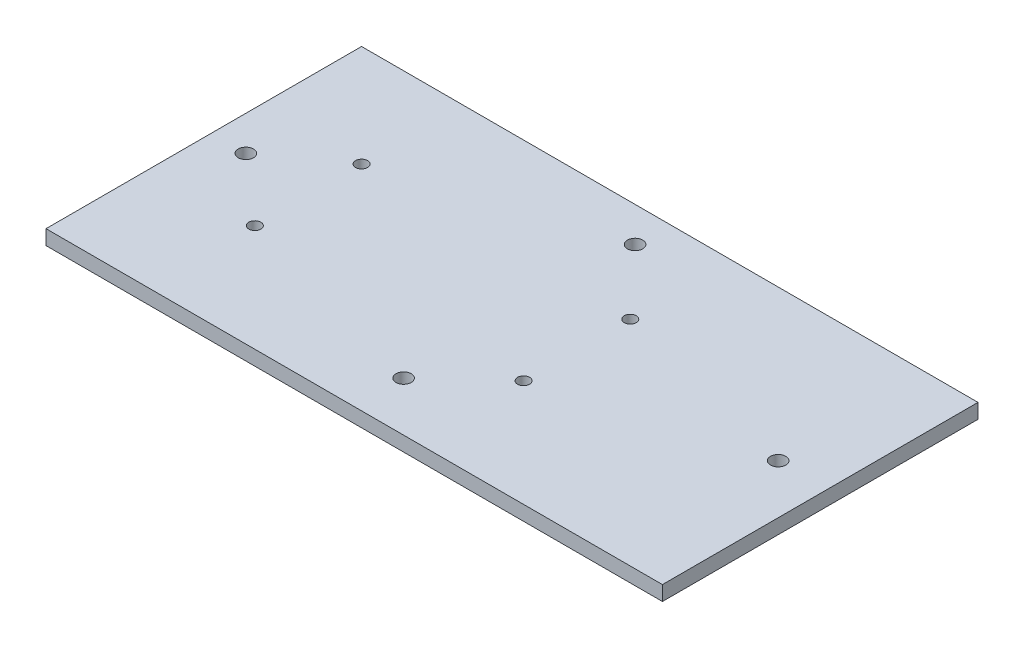
from build123d import *

# Parameters (mm, degrees)
SKETCH1_W           = 133.175
SKETCH1_H           = 68.175
SKETCH1_R           = 1.65
BOSS_EXTRUDE1_DEPTH = 3.175
SKETCH2_R           = 1.3
CUT_EXTRUDE1_DEPTH  = 3.175


with BuildPart() as part:
    # Sketch1 → Boss-Extrude1 (new body)
    with BuildSketch(Plane(origin=(0, 0, 0), x_dir=(1, 0, 0), z_dir=(0, 1, 0))):
        Rectangle(SKETCH1_W, SKETCH1_H)
        with Locations(Location((0, 26.5875, 0), (0, 0, 270))):
            Circle(SKETCH1_R, mode=Mode.SUBTRACT)
        with Locations(Location((-59.0875, 1.5875, 0), (0, 0, 270))):
            Circle(SKETCH1_R, mode=Mode.SUBTRACT)
        with Locations(Location((55.9125, 1.5875, 0), (0, 0, 270))):
            Circle(SKETCH1_R, mode=Mode.SUBTRACT)
        with Locations(Location((0, -23.4125, 0), (0, 0, 270))):
            Circle(SKETCH1_R, mode=Mode.SUBTRACT)
    extrude(amount=BOSS_EXTRUDE1_DEPTH)

    # Sketch2 → Cut-Extrude1 (cut)
    with BuildSketch(Plane.XZ):
        with Locations(Location((-44.5875, 10.9625, 0), (0, 0, 270))):
            Circle(SKETCH2_R)
        with Locations(Location((-44.5875, -12.0875, 0), (0, 0, 270))):
            Circle(SKETCH2_R)
        with Locations(Location((13.4625, -12.0875, 0), (0, 0, 270))):
            Circle(SKETCH2_R)
        with Locations(Location((13.4625, 10.9625, 0), (0, 0, 270))):
            Circle(SKETCH2_R)
    extrude(amount=-CUT_EXTRUDE1_DEPTH, mode=Mode.SUBTRACT)


solid = part.part
